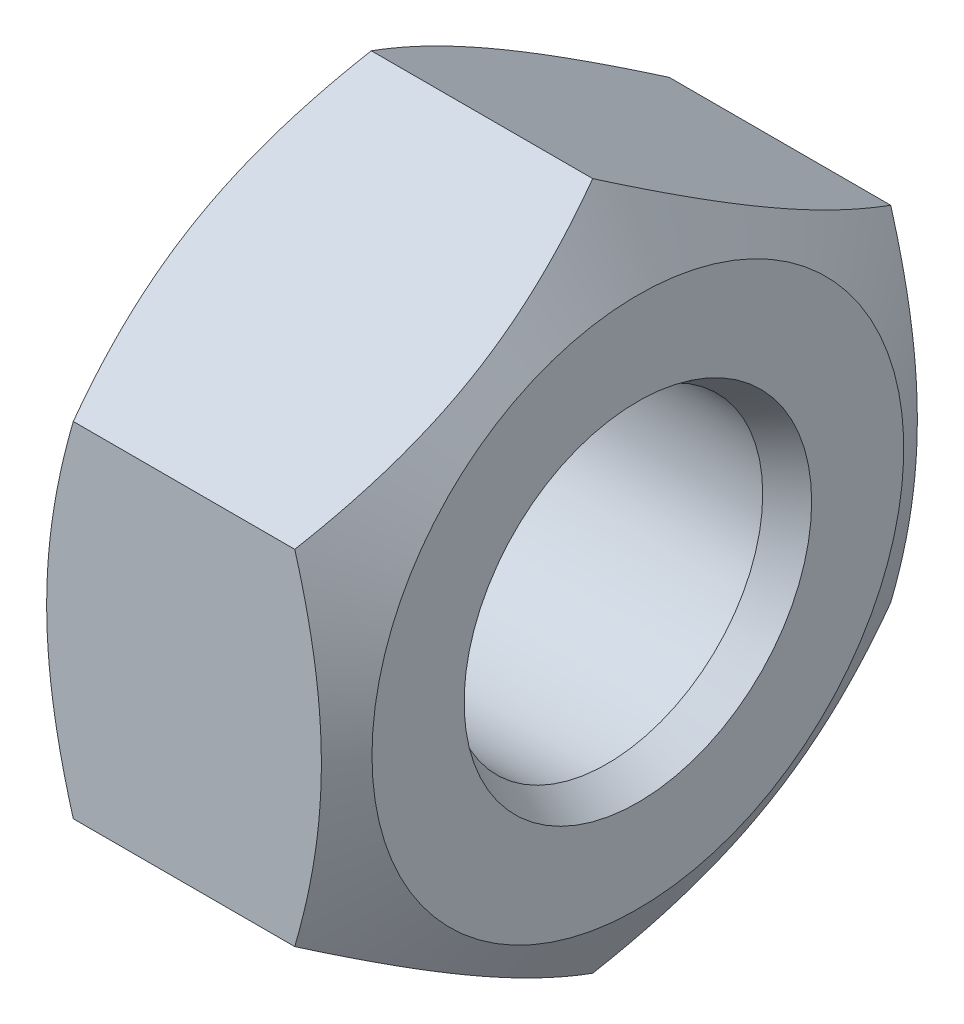
from build123d import *
from OCP.BRepFilletAPI import BRepFilletAPI_MakeChamfer

# Parameters (mm, degrees)
BODY_DEPTH     = 6.8
THREAD_D       = 6.8
CHAMFER3_SIZE  = 0.676582347
CHAMFER3_SIZE2 = 0.390625


with BuildPart() as part:
    # Sketch1 → Body (new body)
    with BuildSketch(Plane.YZ):
        Polygon((-7.505553499, 0), (-3.75277675, 6.5), (3.75277675, 6.5), (7.505553499, 0), (3.75277675, -6.5), (-3.75277675, -6.5), align=None)
    extrude(amount=BODY_DEPTH)

    # Sketch2 → Chamfer1 (revolve, cut)
    with BuildSketch(Plane.XY, mode=Mode.PRIVATE) as chamfer1_sk:
        Polygon((0, 5.8), (0.984701772, 7.505553499), (0, 7.505553499), align=None)
        Polygon((6.8, 5.8), (6.8, 7.505553499), (5.815298228, 7.505553499), align=None)
    revolve(chamfer1_sk.sketch.rotate(Axis((-1.36, 0, 0), (1, 0, 0)), 299.999999999), axis=Axis((-1.36, 0, 0), (1, 0, 0)), mode=Mode.SUBTRACT)

    # Thread (through all)
    with Locations(Plane(origin=(6.8, 0, 0), x_dir=(0, 0, -1), z_dir=(1, 0, 0))):
        with Locations((0, 0)):
            Hole(THREAD_D / 2)

    # Chamfer3: one chamfer whose edges measure the first distance from different faces: ONE call of the kernel's chamfer builder (chamfer() names one face for all edges)
    chamfer3_edges_1 = [part.edges().sort_by_distance(p)[0] for p in [
        (6.8, 0, -3.4),
    ]]
    chamfer3_side_1 = [part.faces().sort_by_distance(p)[0] for p in [
        (3.4, 0, -3.4),
    ]]
    chamfer3_edges_2 = [part.edges().sort_by_distance(p)[0] for p in [
        (0, 0, -3.4),
    ]]
    chamfer3_side_2 = [part.faces().sort_by_distance(p)[0] for p in [
        (0, -2.817975613, 4.880876937),
    ]]
    chamfer3 = BRepFilletAPI_MakeChamfer(part.part.solid().wrapped)
    for e in chamfer3_edges_1:
        chamfer3.Add(CHAMFER3_SIZE, CHAMFER3_SIZE2, e.wrapped, chamfer3_side_1[0].wrapped)  # the first distance lies on this face
    for e in chamfer3_edges_2:
        chamfer3.Add(CHAMFER3_SIZE, CHAMFER3_SIZE2, e.wrapped, chamfer3_side_2[0].wrapped)  # the first distance lies on this face
    add(Compound.cast(chamfer3.Shape()), mode=Mode.REPLACE)


solid = part.part
